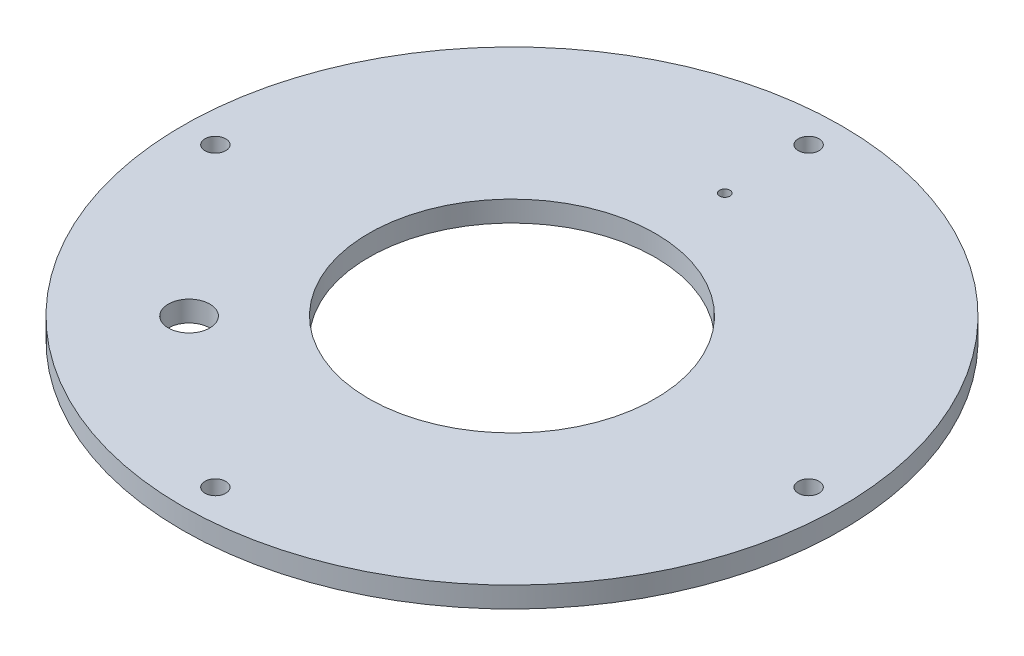
from build123d import *

# Parameters (mm, degrees)
SKETCH1_R                                       = 15.875
SKETCH1_R_2                                     = 6.9
BOSS_EXTRUDE1_DEPTH                             = 1
CSK_FOR_M2_FLAT_HEAD_MACHINE_SCREW1_D           = 1
CSK_FOR_M2_FLAT_HEAD_MACHINE_SCREW1_CSINK_D     = 1.6
CSK_FOR_M2_FLAT_HEAD_MACHINE_SCREW1_CSINK_ANGLE = 100
CUT_EXTRUDE1_DEPTH                              = 23.472900347
CUT_EXTRUDE1_DEPTH_BACK                         = 23.472900347
SKETCH4_R                                       = 0.25
SKETCH4_R_2                                     = 1


with BuildPart() as part:
    # Sketch1 → Boss-Extrude1 (new body)
    with BuildSketch(Plane(origin=(0, 0, 0), x_dir=(1, 0, 0), z_dir=(0, 1, 0))):
        with Locations(Location((0, 0, 0), (0, 0, 270))):
            Circle(SKETCH1_R)
        with Locations(Location((0, 0, 0), (0, 0, 270))):
            Circle(SKETCH1_R_2, mode=Mode.SUBTRACT)
    extrude(amount=BOSS_EXTRUDE1_DEPTH)

    # CSK for M2 Flat Head Machine Screw1 (through all)
    with Locations(Plane(origin=(0, 0, 0), x_dir=(-1, 0, 0), z_dir=(0, -1, 0))):
        with Locations((0, -14.29), (-14.29, 0), (0, 14.29), (14.29, 0)):
            CounterSinkHole(CSK_FOR_M2_FLAT_HEAD_MACHINE_SCREW1_D / 2, CSK_FOR_M2_FLAT_HEAD_MACHINE_SCREW1_CSINK_D / 2, counter_sink_angle=CSK_FOR_M2_FLAT_HEAD_MACHINE_SCREW1_CSINK_ANGLE)

    # Sketch4 → Cut-Extrude1 (cut, two sides: drawn at the far end of the back side and taken through both)
    with BuildSketch(Plane(origin=(0, 1, 0), x_dir=(1, 0, 0), z_dir=(0, 1, 0)).offset(-CUT_EXTRUDE1_DEPTH_BACK)):
        with Locations(Location((0, 10.25, 0), (0, 0, 270))):
            Circle(SKETCH4_R)
        with Locations(Location((-7.778174593, -7.778174593, 0), (0, 0, 270))):
            Circle(SKETCH4_R_2)
    extrude(amount=CUT_EXTRUDE1_DEPTH + CUT_EXTRUDE1_DEPTH_BACK, mode=Mode.SUBTRACT)


solid = part.part
